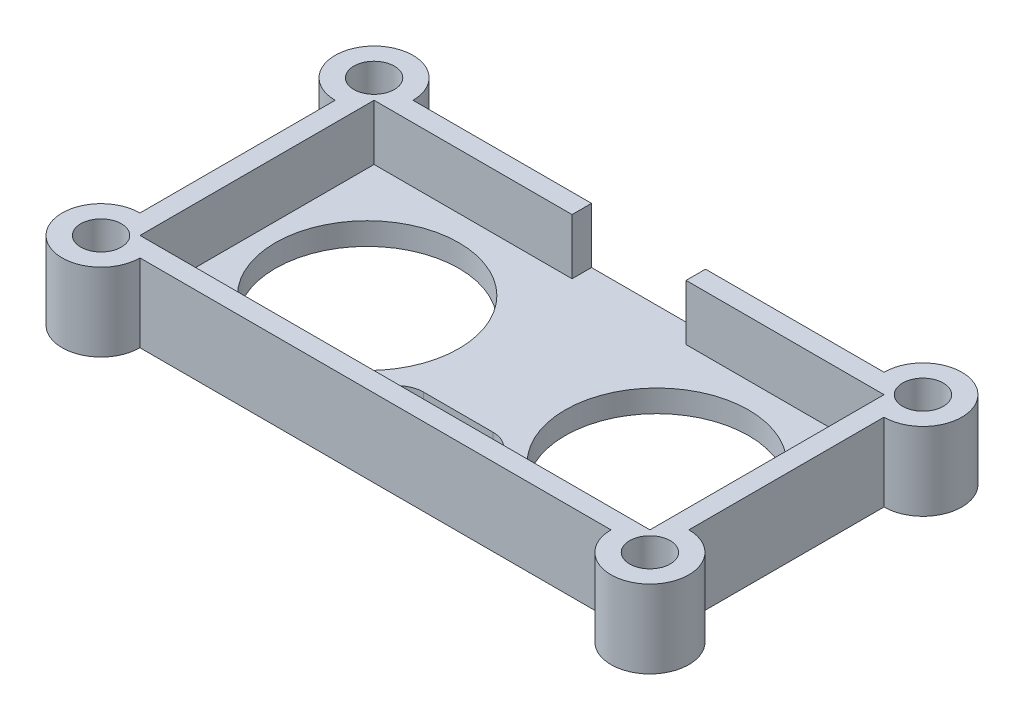
from build123d import *

# Parameters (mm, degrees)
SKETCH1_W               = 49.35
SKETCH1_H               = 24.55
BOSS_EXTRUDE1_DEPTH     = 2
BOSS_EXTRUDE2_DEPTH     = 5
BOSS_EXTRUDE3_START     = -2
BOSS_EXTRUDE3_DEPTH     = 7
CUT_EXTRUDE1_DEPTH      = 33.675392117
CUT_EXTRUDE1_DEPTH_BACK = 33.675392117
SKETCH3_R               = 8.25
SKETCH3_R_2             = 1.825


with BuildPart() as part:
    # Sketch1 → Boss-Extrude1 (new body)
    with BuildSketch(Plane(origin=(0, 0, 0), x_dir=(1, 0, 0), z_dir=(0, 1, 0))):
        Rectangle(SKETCH1_W, SKETCH1_H)
    extrude(amount=BOSS_EXTRUDE1_DEPTH)

    # Sketch2 → Boss-Extrude2 (add)
    with BuildSketch(Plane(origin=(0, 2, 0), x_dir=(1, 0, 0), z_dir=(0, 1, 0))):
        Polygon((-24.675, 12.275), (-24.675, -12.275), (24.675, -12.275), (24.675, 12.275), (5.125, 12.275), (5.125, 10.525), (22.925, 10.525), (22.925, -10.525), (-22.925, -10.525), (-22.925, 10.525), (-5.125, 10.525), (-5.125, 12.275), align=None)
    extrude(amount=BOSS_EXTRUDE2_DEPTH)

    # Sketch4 → Boss-Extrude3 (add)
    with BuildSketch(Plane(origin=(0, 2, 0), x_dir=(1, 0, 0), z_dir=(0, 1, 0)).offset(BOSS_EXTRUDE3_START)):
        with BuildLine():
            Line((-24.675, 12.275), (-24.675, 8.775))
            ThreePointArc((-24.675, 8.775), (-27.149873734, 14.749873734), (-21.175, 12.275))
            Line((-21.175, 12.275), (-24.675, 12.275))
        make_face()
        with BuildLine():
            Line((-24.675, -12.275), (-24.675, -8.775))
            ThreePointArc((-24.675, -8.775), (-27.149873734, -14.749873734), (-21.175, -12.275))
            Line((-21.175, -12.275), (-24.675, -12.275))
        make_face()
        with BuildLine():
            Line((24.675, -12.275), (21.175, -12.275))
            ThreePointArc((21.175, -12.275), (27.149873734, -14.749873734), (24.675, -8.775))
            Line((24.675, -8.775), (24.675, -12.275))
        make_face()
        with BuildLine():
            Line((24.675, 8.775), (24.675, 12.275))
            Line((24.675, 12.275), (21.175, 12.275))
            ThreePointArc((21.175, 12.275), (27.149873734, 14.749873734), (24.675, 8.775))
        make_face()
    extrude(amount=BOSS_EXTRUDE3_DEPTH)

    # Sketch3 → Cut-Extrude1 (cut, two sides: drawn at the far end of the back side and taken through both)
    with BuildSketch(Plane(origin=(0, 2, 0), x_dir=(1, 0, 0), z_dir=(0, 1, 0)).offset(-CUT_EXTRUDE1_DEPTH_BACK)):
        with Locations(Location((-13.025, 0, 0), (0, 0, 270))):
            Circle(SKETCH3_R)
        with Locations(Location((13.025, 0, 0), (0, 0, 270))):
            Circle(SKETCH3_R)
        with Locations(Location((-24.675, 12.275, 0), (0, 0, 270))):
            Circle(SKETCH3_R_2)
        with Locations(Location((-24.675, -12.275, 0), (0, 0, 270))):
            Circle(SKETCH3_R_2)
        with Locations(Location((24.675, 12.275, 0), (0, 0, 270))):
            Circle(SKETCH3_R_2)
        with Locations(Location((24.675, -12.275, 0), (0, 0, 270))):
            Circle(SKETCH3_R_2)
        with BuildLine():
            Line((-3, -4.975), (3.25, -4.975))
            ThreePointArc((3.25, -4.975), (5.625, -7.35), (3.25, -9.725))
            Line((3.25, -9.725), (-3, -9.725))
            ThreePointArc((-3, -9.725), (-5.375, -7.35), (-3, -4.975))
        make_face()
    extrude(amount=CUT_EXTRUDE1_DEPTH + CUT_EXTRUDE1_DEPTH_BACK, mode=Mode.SUBTRACT)


solid = part.part
